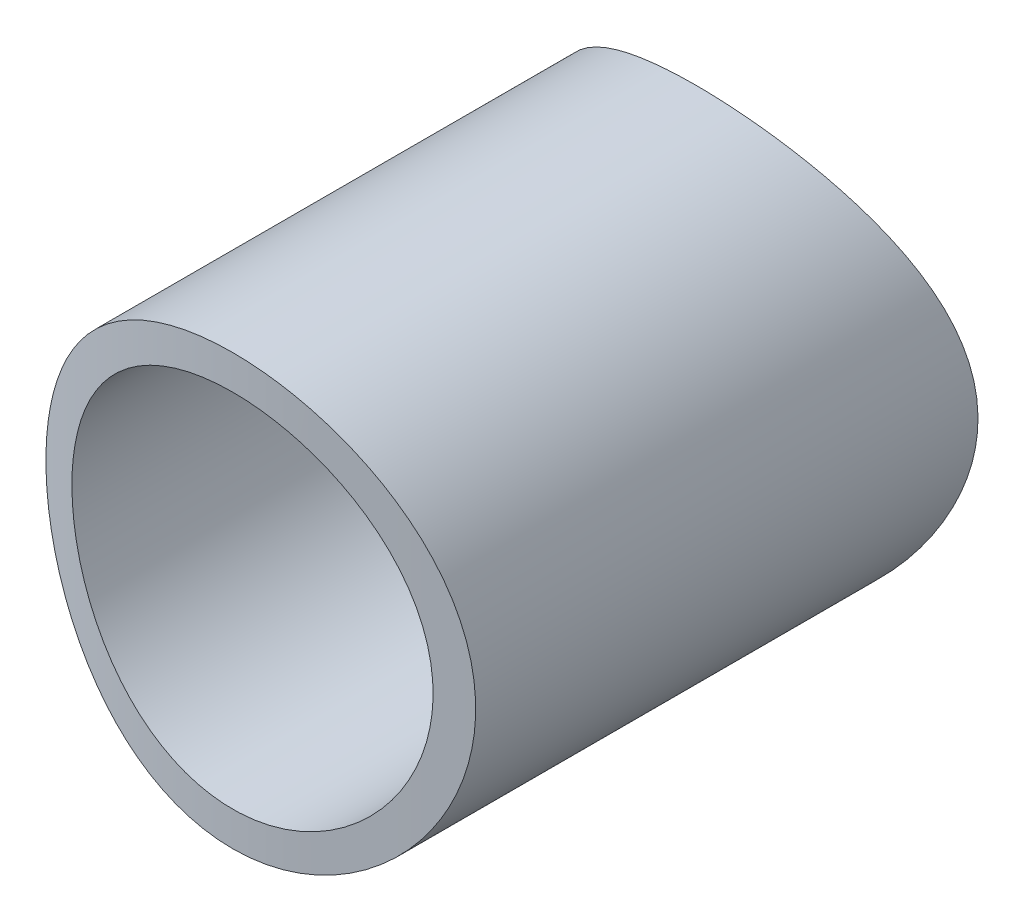
from build123d import *

# Parameters (mm, degrees)
SKETCH1_R               = 12.53
SKETCH1_R_2             = 10.53
BOSS_EXTRUDE1_DEPTH     = 60
CUT_EXTRUDE1_DEPTH      = 63.561983664
CUT_EXTRUDE1_DEPTH_BACK = 63.561983664
SKETCH2_R               = 74.589724577
SKETCH2_R_2             = 49
SKETCH2_R_3             = 22


with BuildPart() as part:
    # Sketch1 → Boss-Extrude1 (new body)
    with BuildSketch(Plane.XY):
        with Locations(Location((0, 0, 0), (0, 0, 180))):
            Circle(SKETCH1_R)
        with Locations(Location((0, 0, 0), (0, 0, 180))):
            Circle(SKETCH1_R_2, mode=Mode.SUBTRACT)
    extrude(amount=BOSS_EXTRUDE1_DEPTH)

    # Sketch2 → Cut-Extrude1 (cut, two sides: drawn at the far end of the back side and taken through both)
    # profile 1 of 2: a face of its own
    with BuildSketch(Plane(origin=(0, 0, 0), x_dir=(1, 0, 0), z_dir=(0, 1, 0)).offset(-CUT_EXTRUDE1_DEPTH_BACK)):
        Circle(SKETCH2_R)
        Circle(SKETCH2_R_2, mode=Mode.SUBTRACT)
    # profile 2 of 2: a face of its own
    with BuildSketch(Plane(origin=(0, 0, 0), x_dir=(1, 0, 0), z_dir=(0, 1, 0)).offset(-CUT_EXTRUDE1_DEPTH_BACK)):
        Circle(SKETCH2_R_3)
    extrude(amount=CUT_EXTRUDE1_DEPTH + CUT_EXTRUDE1_DEPTH_BACK, mode=Mode.SUBTRACT)


solid = part.part
